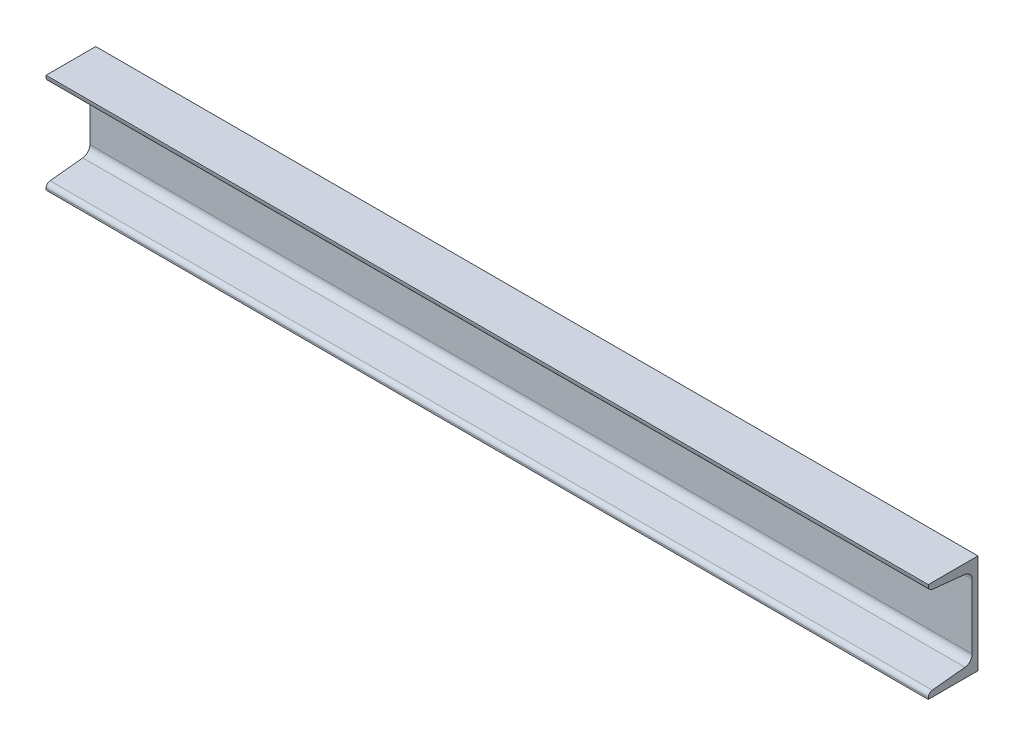
from build123d import *

# Parameters (mm, degrees)
C_CHANNEL_100_X_10_1_DEPTH = 887


with BuildPart() as part:
    # Sketch13 → C channel 100 X 10(1) (new body)
    with BuildSketch(Plane.ZY):
        with BuildLine():
            Line((50, 100), (0, 100))
            Line((0, 100), (0, 0))
            Line((0, 0), (50, 0))
            Line((50, 0), (50, 1.629852671))
            ThreePointArc((50, 1.629852671), (48.844151715, 4.6409404), (45.970378085, 6.1052012))
            Line((45.970378085, 6.1052012), (13.063772294, 9.563824837))
            ThreePointArc((13.063772294, 9.563824837), (7.954841396, 12.166955149), (5.9, 17.52))
            Line((5.9, 17.52), (5.9, 82.48))
            ThreePointArc((5.9, 82.48), (7.954841396, 87.833044851), (13.063772294, 90.436175163))
            Line((13.063772294, 90.436175163), (45.970378085, 93.8947988))
            ThreePointArc((45.970378085, 93.8947988), (48.844151715, 95.3590596), (50, 98.370147329))
            Line((50, 98.370147329), (50, 100))
        make_face()
    extrude(amount=C_CHANNEL_100_X_10_1_DEPTH)


solid = part.part
